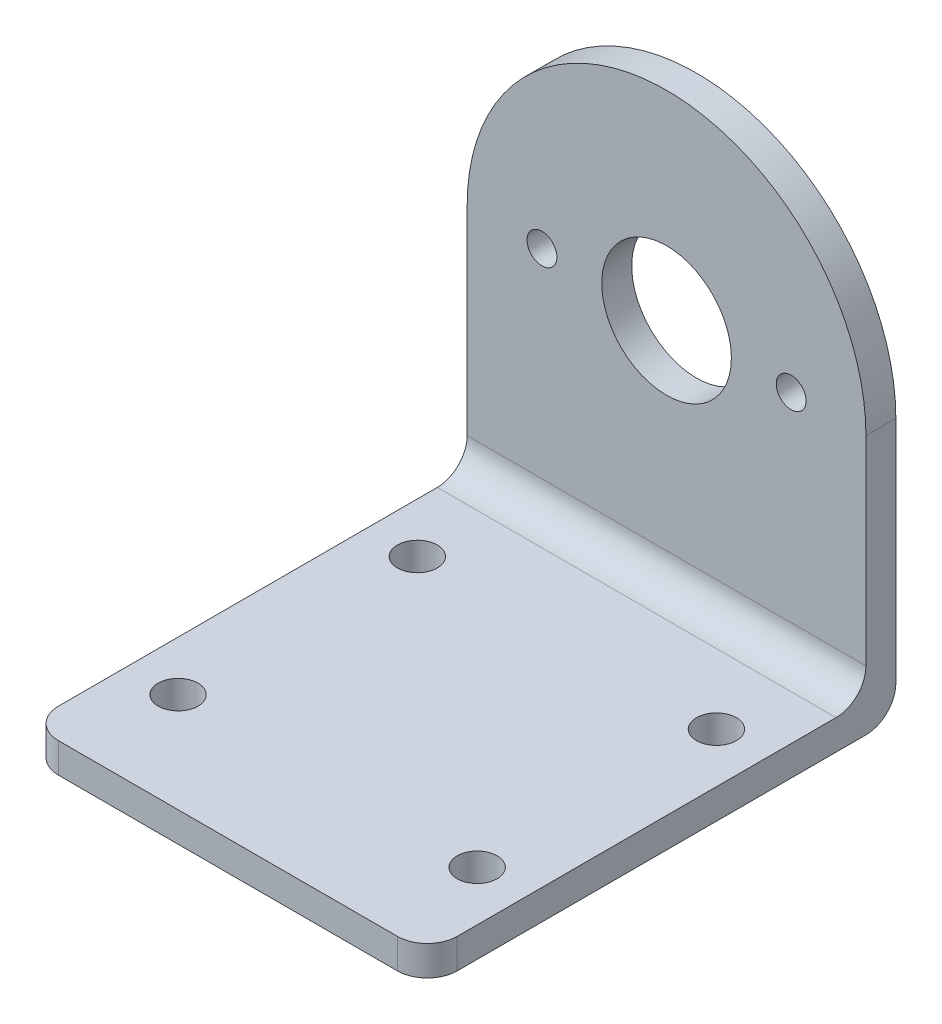
from build123d import *

# Parameters (mm, degrees)
SKETCH_1_R          = 6.5
SKETCH_1_R_2        = 1.5
EXTRUDE_1_DEPTH     = 3
SKETCH_2_W          = 40
SKETCH_2_H          = 3
EXTRUDE_2_DEPTH     = 44
FILLET_4_R          = 3
SKETCH_3_R          = 2
CUT_EXTRUDE_1_DEPTH = 77.974021592
FILLET_5_R          = 3
FILLET_6_R          = 3


with BuildPart() as part:
    # Эскиз1 → Бобышка-Вытянуть1 (new body)
    with BuildSketch(Plane.XY):
        with BuildLine():
            Line((0, 0), (40, 0))
            Line((40, 0), (40, 26))
            ThreePointArc((40, 26), (20, 46), (0, 26))
            Line((0, 26), (0, 0))
        make_face()
        with Locations((20, 26)):
            Circle(SKETCH_1_R, mode=Mode.SUBTRACT)
        with Locations((32.5, 26)):
            Circle(SKETCH_1_R_2, mode=Mode.SUBTRACT)
        with Locations((7.5, 26)):
            Circle(SKETCH_1_R_2, mode=Mode.SUBTRACT)
    extrude(amount=EXTRUDE_1_DEPTH)

    # Эскиз2 → Бобышка-Вытянуть2 (add)
    with BuildSketch(Plane.XY.offset(3)):
        with Locations((20, 1.5)):
            Rectangle(SKETCH_2_W, SKETCH_2_H)
    extrude(amount=EXTRUDE_2_DEPTH)

    # Скругление4
    fillet_4_edges = [part.edges().sort_by_distance(p)[0] for p in [
        (20, 0, 0),
    ]]
    fillet(fillet_4_edges, radius=FILLET_4_R)

    # Эскиз3 → Вырез-Вытянуть1 (cut, through all)
    with BuildSketch(Plane.XZ):
        with Locations(Location((5, 37, 0), (0, 0, 270))):
            Circle(SKETCH_3_R)
        with Locations(Location((35, 37, 0), (0, 0, 270))):
            Circle(SKETCH_3_R)
        with Locations(Location((5, 13, 0), (0, 0, 270))):
            Circle(SKETCH_3_R)
        with Locations(Location((35, 13, 0), (0, 0, 270))):
            Circle(SKETCH_3_R)
    extrude(amount=-CUT_EXTRUDE_1_DEPTH, mode=Mode.SUBTRACT)

    # Скругление5
    fillet_5_edges = [part.edges().sort_by_distance(p)[0] for p in [
        (20, 3, 3),
    ]]
    fillet(fillet_5_edges, radius=FILLET_5_R)

    # Скругление6
    fillet_6_edges = [part.edges().sort_by_distance(p)[0] for p in [
        (40, 1.5, 47),
        (0, 1.5, 47),
    ]]
    fillet(fillet_6_edges, radius=FILLET_6_R)


solid = part.part
